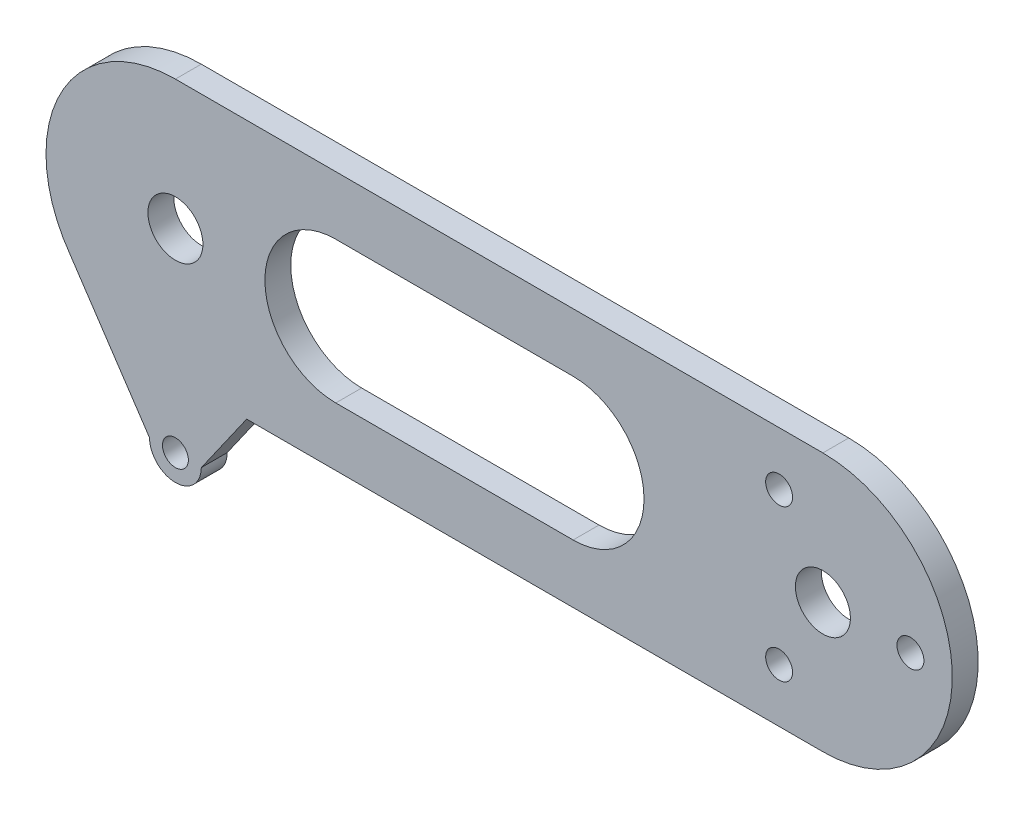
from build123d import *

# Parameters (mm, degrees)
SKETCH_1_R      = 4.25
SKETCH_1_R_2    = 2.08
SKETCH_1_R_3    = 2
EXTRUDE_1_DEPTH = 4


with BuildPart() as part:
    # 草图1 → 凸台-拉伸1 (new body)
    with BuildSketch(Plane.XY):
        with BuildLine():
            Line((-1, 20), (99.064295006, 20))
            ThreePointArc((99.064295006, 20), (119.064295006, 0), (99.064295006, -20))
            Line((99.064295006, -20), (10.014533743, -20))
            Line((10.014533743, -20), (3, -30))
            ThreePointArc((3, -30), (-1, -34), (-5, -30))
            Line((-5, -30), (-17.208156126, -11.717323713))
            ThreePointArc((-17.208156126, -11.717323713), (-18.809358134, 9.10092099), (-1, 20))
        make_face()
        with Locations((-1, 0)):
            Circle(SKETCH_1_R, mode=Mode.SUBTRACT)
        with Locations((99.064295006, 0)):
            Circle(SKETCH_1_R, mode=Mode.SUBTRACT)
        with Locations((112.594295006, 0)):
            Circle(SKETCH_1_R_2, mode=Mode.SUBTRACT)
        with Locations((92.299295006, -11.717323713)):
            Circle(SKETCH_1_R_2, mode=Mode.SUBTRACT)
        with Locations((92.299295006, 11.717323713)):
            Circle(SKETCH_1_R_2, mode=Mode.SUBTRACT)
        with Locations((-1, -30)):
            Circle(SKETCH_1_R_3, mode=Mode.SUBTRACT)
        with BuildLine():
            Line((23.78352134, 10.95385289), (60.46647866, 10.95385289))
            ThreePointArc((60.46647866, 10.95385289), (71.420331549, 0), (60.46647866, -10.95385289))
            Line((60.46647866, -10.95385289), (23.78352134, -10.95385289))
            ThreePointArc((23.78352134, -10.95385289), (12.829668451, 0), (23.78352134, 10.95385289))
        make_face(mode=Mode.SUBTRACT)
    extrude(amount=EXTRUDE_1_DEPTH)


solid = part.part
